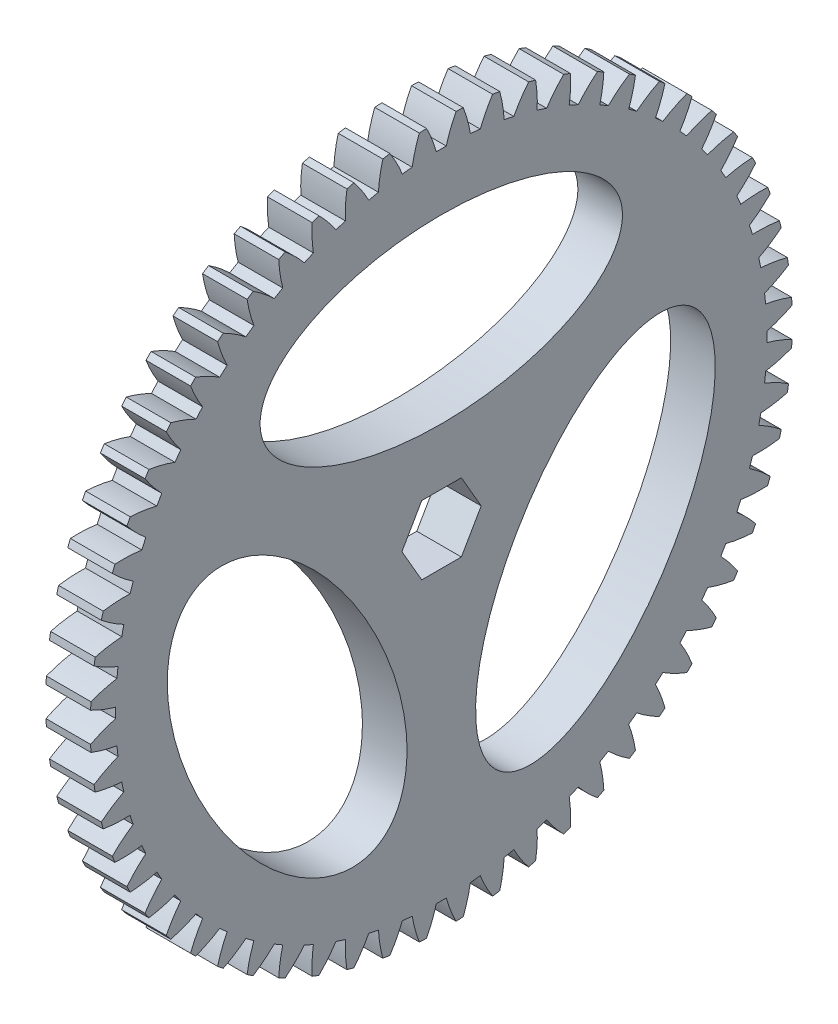
from build123d import *

# Parameters (mm, degrees)
BASPROSKE_W        = 4.99999
BASPROSKE_H        = 39.37
TOOTHCUT_DEPTH     = 56.901643089
TEETHCUTS_COUNT    = 60
TEETHCUTS_ANGLE    = 354
BORSKE_R           = 0.396875
BORE_DEPTH         = 50.8000508
CUT_EXTRUDE1_DEPTH = 56.852593884
SKETCH2_RX         = 20.32
SKETCH2_RY         = 10.16
CUT_EXTRUDE2_DEPTH = 56.852593884
CIRPATTERN1_COUNT  = 3


with BuildPart() as part:
    # BasProSke → Base-Revolve (revolve)
    with BuildSketch(Plane(origin=(0, 0, 0), x_dir=(1, 0, 0), z_dir=(0, 1, 0)), mode=Mode.PRIVATE) as base_revolve_sk:
        with Locations((2.499995, 19.685)):
            Rectangle(BASPROSKE_W, BASPROSKE_H)
    revolve(base_revolve_sk.sketch.rotate(Axis((-10, 0, 0), (1, 0, 0)), 180), axis=Axis((-10, 0, 0), (1, 0, 0)))

    # TooCutSke → ToothCut (cut, through all)
    with BuildSketch(Plane(origin=(0, 0, 0), x_dir=(0, 0, -1), z_dir=(1, 0, 0))):
        with BuildLine():
            ThreePointArc((0.554451235, 36.520991483), (0, 36.5252), (-0.554451235, 36.520991483))
            ThreePointArc((-0.554451235, 36.520991483), (-1.040157024, 37.968457667), (-1.668254373, 39.360061846))
            ThreePointArc((-1.668254373, 39.360061846), (0, 39.3954), (1.668254373, 39.360061846))
            ThreePointArc((1.668254373, 39.360061846), (1.040157024, 37.968457667), (0.554451235, 36.520991483))
        make_face()
    toothcut = extrude(amount=TOOTHCUT_DEPTH, mode=Mode.SUBTRACT)

    # TeethCuts: ToothCut ×60 about axis
    teethcuts_axis = Axis((-10, 0, 0), (1, 0, 0))
    for i in range(1, TEETHCUTS_COUNT):
        add(toothcut.rotate(teethcuts_axis, i * TEETHCUTS_ANGLE / (TEETHCUTS_COUNT - 1)), mode=Mode.SUBTRACT)

    # BorSke → Bore (cut, symmetric)
    with BuildSketch(Plane(origin=(0, 0, 0), x_dir=(0, 0, -1), z_dir=(1, 0, 0))):
        with Locations(Location((0, 0, 0), (0, 0, 180))):
            Circle(BORSKE_R)
    extrude(amount=BORE_DEPTH, both=True, mode=Mode.SUBTRACT)

    # Sketch1 → Cut-Extrude1 (cut, through all)
    with BuildSketch(Plane(origin=(4.99999, 0, 0), x_dir=(0, 0, -1), z_dir=(1, 0, 0))):
        Polygon((2.251783614, 3.453689747), (-2.193216386, 3.453689747), (-4.415716386, -0.395793173), (-2.193216386, -4.245276093), (2.251783614, -4.245276093), (4.474283614, -0.395793173), align=None)
    extrude(amount=-CUT_EXTRUDE1_DEPTH, mode=Mode.SUBTRACT)

    # Sketch2 → Cut-Extrude2 (cut, through all)
    with BuildSketch(Plane(origin=(4.99999, 0, 0), x_dir=(0, 0, -1), z_dir=(1, 0, 0))):
        with Locations(Location((0, 19.963689747), (0, 0, 0))):
            Ellipse(SKETCH2_RX, SKETCH2_RY)
    cut_extrude2 = extrude(amount=-CUT_EXTRUDE2_DEPTH, mode=Mode.SUBTRACT)

    # CirPattern1: Cut-Extrude2 ×3 about axis
    cirpattern1_axis = Axis((4.99999, 0, 0), (-1, 0, 0))
    for i in range(1, CIRPATTERN1_COUNT):
        add(cut_extrude2.rotate(cirpattern1_axis, i * 360 / CIRPATTERN1_COUNT), mode=Mode.SUBTRACT)


solid = part.part
